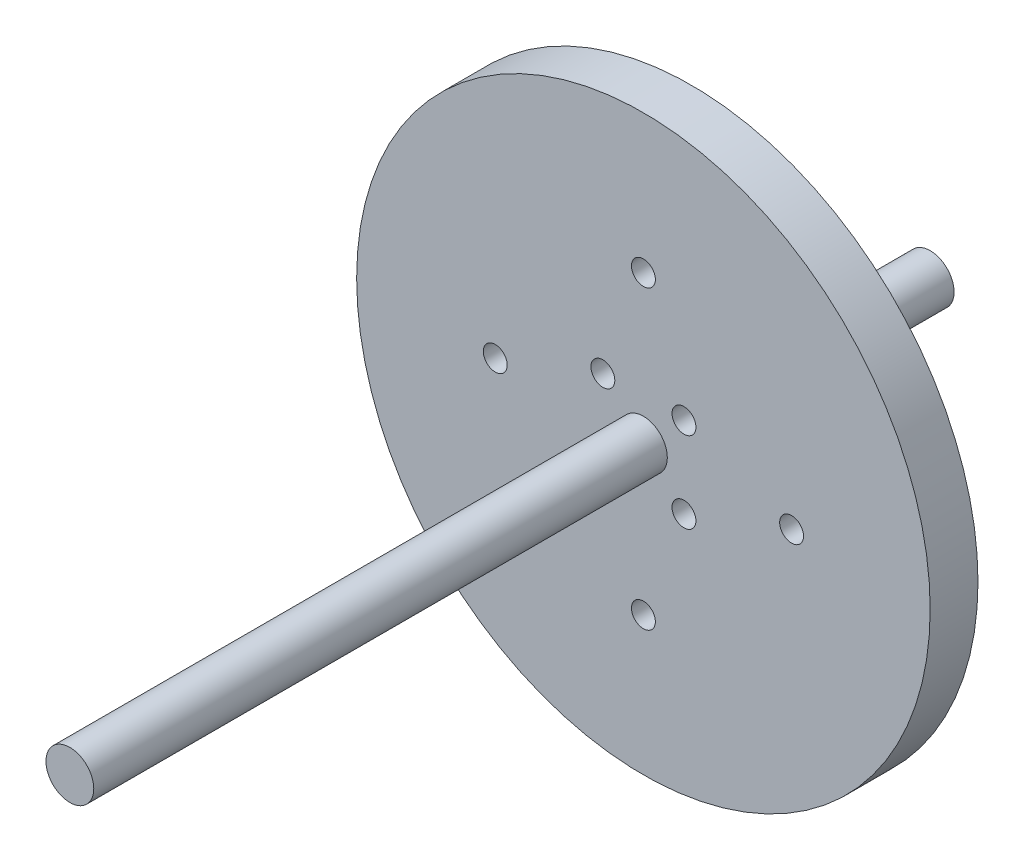
from build123d import *

# Parameters (mm, degrees)
SKETCH1_R           = 30
BOSS_EXTRUDE1_DEPTH = 5
SKETCH2_R           = 1.25
CUT_EXTRUDE1_DEPTH  = 5
SKETCH3_R           = 2.5
BOSS_EXTRUDE2_DEPTH = 25
BOSS_EXTRUDE3_START = 60
SKETCH4_R           = 2.5
BOSS_EXTRUDE3_DEPTH = 60


with BuildPart() as part:
    # Sketch1 → Boss-Extrude1 (new body)
    with BuildSketch(Plane.XY):
        Circle(SKETCH1_R)
    extrude(amount=BOSS_EXTRUDE1_DEPTH)

    # Sketch2 → Cut-Extrude1 (cut)
    with BuildSketch(Plane.XY.offset(5)):
        with Locations((0, 15.5)):
            Circle(SKETCH2_R)
        with Locations((15.5, 0)):
            Circle(SKETCH2_R)
        with Locations((0, -15.5)):
            Circle(SKETCH2_R)
        with Locations((-15.5, 0)):
            Circle(SKETCH2_R)
        with Locations((4.242640687, 4.242640687)):
            Circle(SKETCH2_R)
        with Locations((4.242640687, -4.242640687)):
            Circle(SKETCH2_R)
        with Locations((-4.242640687, -4.242640687)):
            Circle(SKETCH2_R)
        with Locations((-4.242640687, 4.242640687)):
            Circle(SKETCH2_R)
    extrude(amount=-CUT_EXTRUDE1_DEPTH, mode=Mode.SUBTRACT)

    # Sketch3 → Boss-Extrude2 (add)
    with BuildSketch(Plane(origin=(0, 0, 0), x_dir=(-1, 0, 0), z_dir=(0, 0, -1))):
        with Locations(Location((0, 0, 0), (0, 0, 180))):
            Circle(SKETCH3_R)
    extrude(amount=BOSS_EXTRUDE2_DEPTH)

    # Sketch4 → Boss-Extrude3 (add)
    with BuildSketch(Plane.XY.offset(5).offset(BOSS_EXTRUDE3_START)):
        Circle(SKETCH4_R)
    extrude(amount=-BOSS_EXTRUDE3_DEPTH)


solid = part.part
